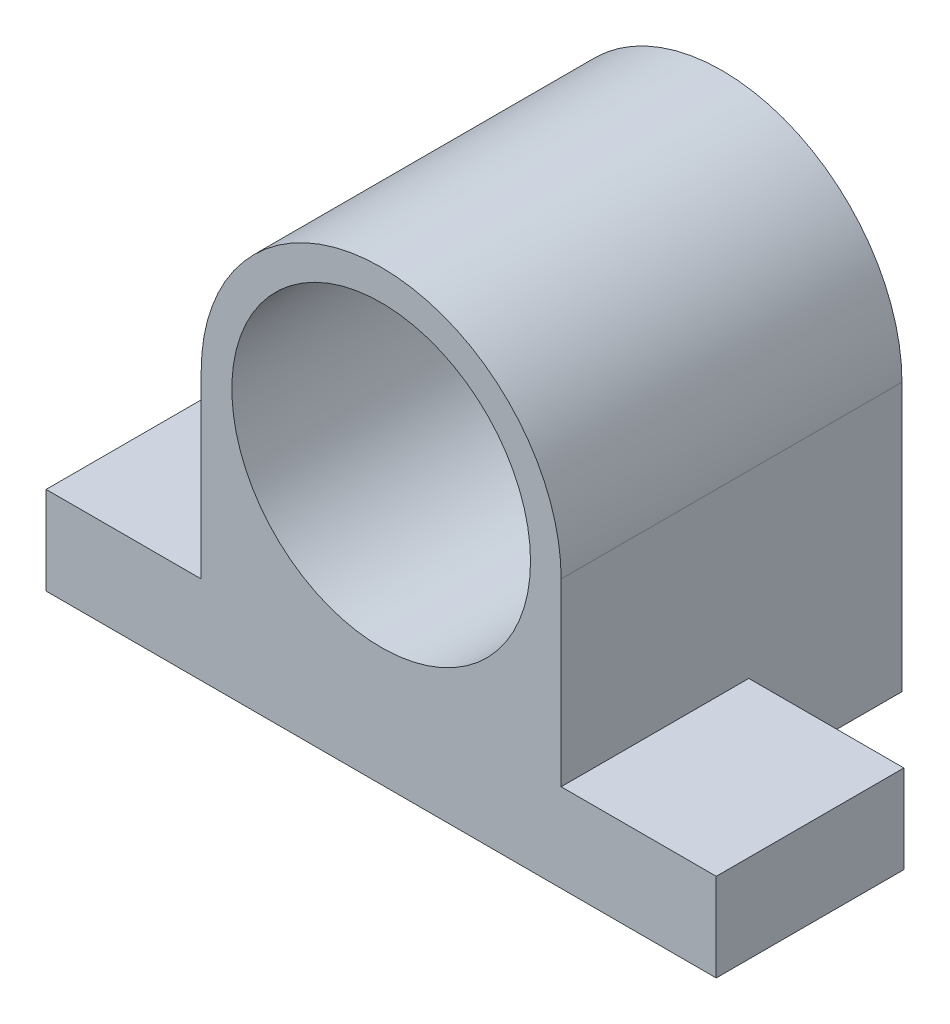
from build123d import *

# Parameters (mm, degrees)
SKETCH1_R           = 8.763
BOSS_EXTRUDE1_DEPTH = 3.556
BOSS_EXTRUDE2_DEPTH = 19.05
SKETCH3_R           = 9.906
CUT_EXTRUDE1_DEPTH  = 17.78
SKETCH4_R           = 6.35
CUT_EXTRUDE2_DEPTH  = 17.78
SKETCH5_W           = 10.287
SKETCH5_H           = 10.16
CUT_EXTRUDE3_DEPTH  = 12.7


with BuildPart() as part:
    # Sketch1 → Boss-Extrude1 (new body)
    with BuildSketch(Plane.XY):
        with BuildLine():
            Line((11.938, 0), (11.938, -11.938))
            Line((11.938, -11.938), (22.225, -11.938))
            Line((22.225, -11.938), (22.225, -17.78))
            Line((22.225, -17.78), (-22.225, -17.78))
            Line((-22.225, -17.78), (-22.225, -11.938))
            Line((-22.225, -11.938), (-11.938, -11.938))
            Line((-11.938, -11.938), (-11.938, 0))
            ThreePointArc((-11.938, 0), (0, 11.938), (11.938, 0))
        make_face()
        Circle(SKETCH1_R, mode=Mode.SUBTRACT)
    extrude(amount=BOSS_EXTRUDE1_DEPTH)

    # Sketch2 → Boss-Extrude2 (add)
    with BuildSketch(Plane.XY.offset(3.556)):
        with BuildLine():
            Line((-11.938, 0), (-11.938, -11.938))
            Line((-11.938, -11.938), (-22.225, -11.938))
            Line((-22.225, -11.938), (-22.225, -17.78))
            Line((-22.225, -17.78), (22.225, -17.78))
            Line((22.225, -17.78), (22.225, -11.938))
            Line((22.225, -11.938), (11.938, -11.938))
            Line((11.938, -11.938), (11.938, 0))
            ThreePointArc((11.938, 0), (0, 11.938), (-11.938, 0))
        make_face()
    extrude(amount=BOSS_EXTRUDE2_DEPTH)

    # Sketch3 → Cut-Extrude1 (cut)
    with BuildSketch(Plane.XY.offset(22.606)):
        Circle(SKETCH3_R)
    extrude(amount=-CUT_EXTRUDE1_DEPTH, mode=Mode.SUBTRACT)

    # Sketch4 → Cut-Extrude2 (cut)
    with BuildSketch(Plane.XY.offset(4.826)):
        Circle(SKETCH4_R)
    extrude(amount=-CUT_EXTRUDE2_DEPTH, mode=Mode.SUBTRACT)

    # Sketch5 → Cut-Extrude3 (cut)
    with BuildSketch(Plane(origin=(0, -11.938, 0), x_dir=(1, 0, 0), z_dir=(0, 1, 0))):
        with Locations((17.0815, -5.08)):
            Rectangle(SKETCH5_W, SKETCH5_H)
        with Locations((-17.0815, -5.08)):
            Rectangle(SKETCH5_W, SKETCH5_H)
    extrude(amount=-CUT_EXTRUDE3_DEPTH, mode=Mode.SUBTRACT)


solid = part.part
